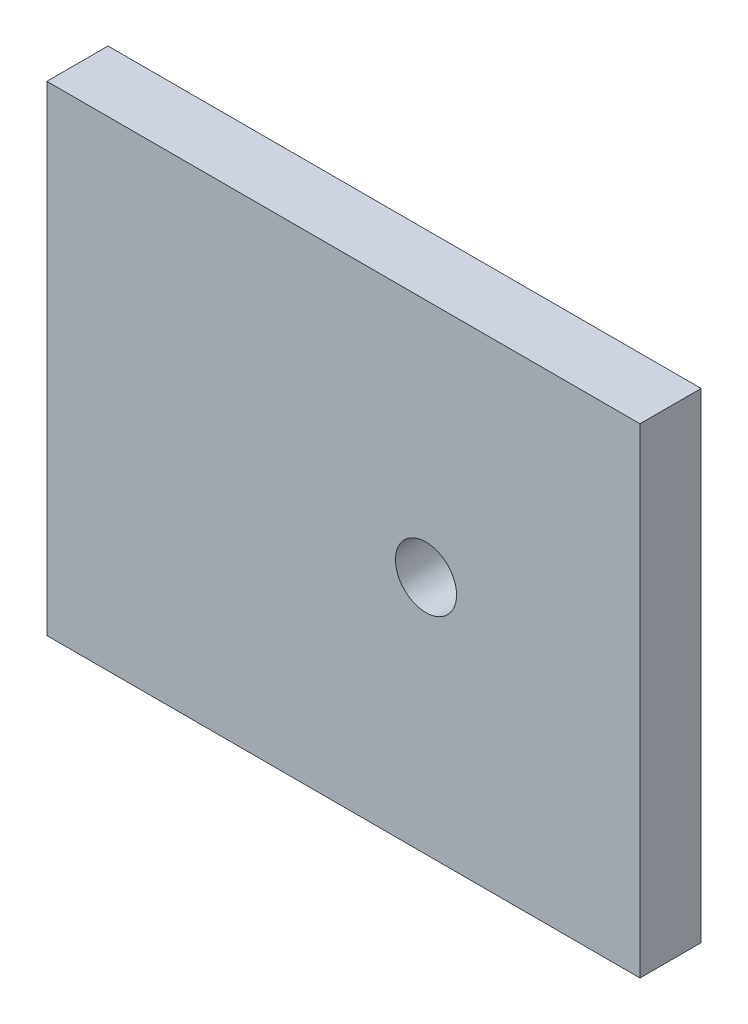
from build123d import *

# Parameters (mm, degrees)
SKETCH1_W           = 97
SKETCH1_H           = 78.5
BOSS_EXTRUDE1_DEPTH = 10
CUT_EXTRUDE1_REACH  = 65.189
SKETCH2_R           = 5
SKETCH3_R           = 11
CUT_EXTRUDE2_DEPTH  = 5


with BuildPart() as part:
    # Sketch1 → Boss-Extrude1 (new body)
    with BuildSketch(Plane.XY):
        Rectangle(SKETCH1_W, SKETCH1_H)
    extrude(amount=BOSS_EXTRUDE1_DEPTH)

    # Sketch2 → Cut-Extrude1 (cut, up to next)
    with BuildSketch(Plane.XY.offset(10), mode=Mode.PRIVATE) as cut_extrude1_sk1:
        with Locations((13.5, 0)):
            Circle(SKETCH2_R)
    cut_extrude1_tool1 = extrude(cut_extrude1_sk1.sketch, amount=-CUT_EXTRUDE1_REACH, mode=Mode.PRIVATE) & part.part
    add(cut_extrude1_tool1.solids().sort_by_distance((13.5, 0, 10))[0], mode=Mode.SUBTRACT)

    # Sketch3 → Cut-Extrude2 (cut)
    with BuildSketch(Plane(origin=(0, 0, 0), x_dir=(-1, 0, 0), z_dir=(0, 0, -1))):
        with Locations((24.25, 0)):
            Circle(SKETCH3_R)
    extrude(amount=-CUT_EXTRUDE2_DEPTH, mode=Mode.SUBTRACT)


solid = part.part
